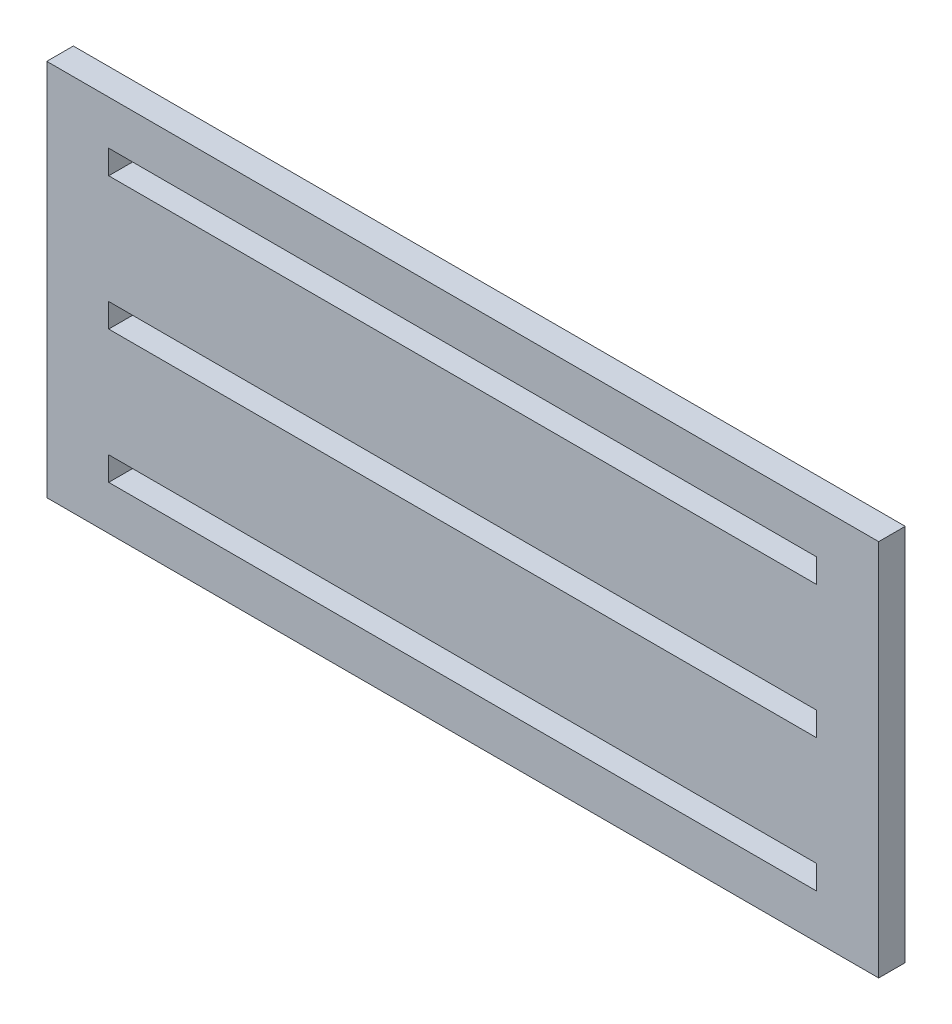
from build123d import *

# Parameters (mm, degrees)
SKETCH_1_W      = 94
SKETCH_1_H      = 42.7
SKETCH_1_W_2    = 80
SKETCH_1_H_2    = 2.7
EXTRUDE_1_DEPTH = 3


with BuildPart() as part:
    # 草圖1 → 填料-伸長1 (new body)
    with BuildSketch(Plane.XY):
        with Locations((33.667848899, -4.460854476)):
            Rectangle(SKETCH_1_W, SKETCH_1_H)
        with Locations((33.667848899, -4.460854476)):
            Rectangle(SKETCH_1_W_2, SKETCH_1_H_2, mode=Mode.SUBTRACT)
        with Locations((33.667848899, 10.539145524)):
            Rectangle(SKETCH_1_W_2, SKETCH_1_H_2, mode=Mode.SUBTRACT)
        with Locations((33.667848899, -19.460854476)):
            Rectangle(SKETCH_1_W_2, SKETCH_1_H_2, mode=Mode.SUBTRACT)
    extrude(amount=EXTRUDE_1_DEPTH)


solid = part.part
